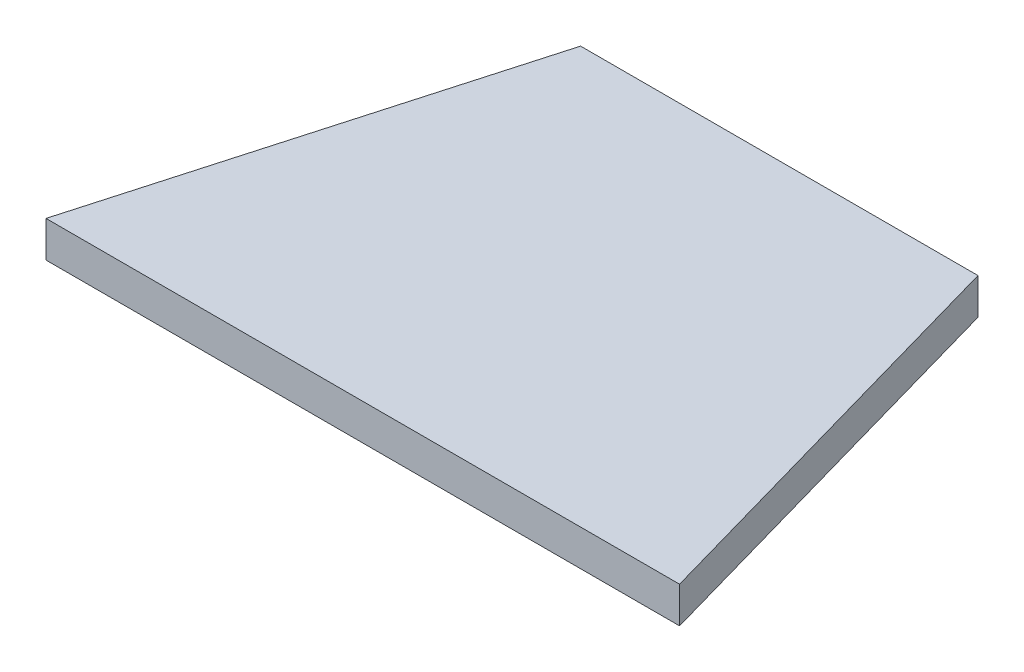
from build123d import *

# Parameters (mm, degrees)
BOSS_EXTRUDE1_DEPTH = 5


with BuildPart() as part:
    # Sketch2 → Boss-Extrude1 (new body)
    with BuildSketch(Plane(origin=(0, 0, 0), x_dir=(1, 0, 0), z_dir=(0, 1, 0))):
        Polygon((27.511850107, 38.952421439), (-27.511850107, 38.952421439), (-43.861496504, -18.717963476), (11.16220371, -18.717963476), (43.861496504, -18.717963476), align=None)
    extrude(amount=BOSS_EXTRUDE1_DEPTH)


solid = part.part
